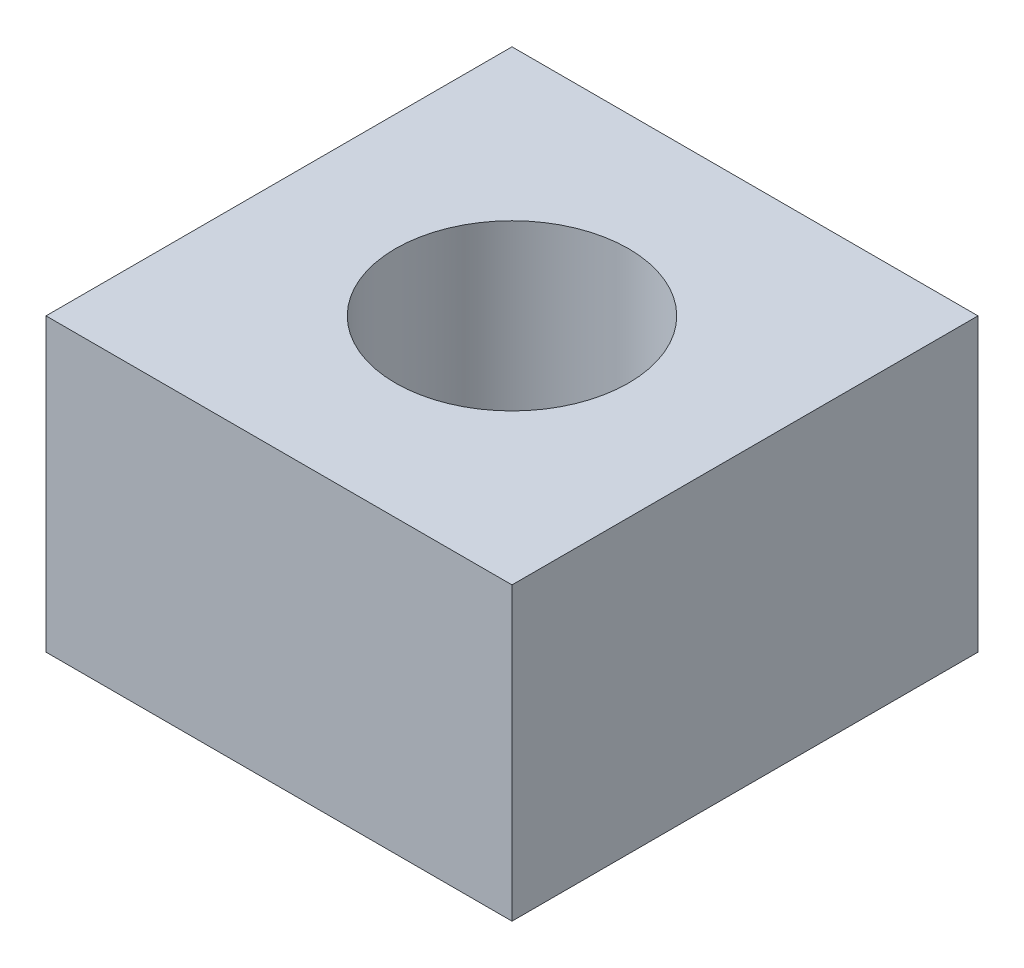
from build123d import *

# Parameters (mm, degrees)
SKETCH_1_W      = 80
SKETCH_1_H      = 80
SKETCH_1_R      = 20
EXTRUDE_1_DEPTH = 50


with BuildPart() as part:
    # 草图1 → 凸台-拉伸1 (new body)
    with BuildSketch(Plane(origin=(0, 0, 0), x_dir=(1, 0, 0), z_dir=(0, 1, 0))):
        Rectangle(SKETCH_1_W, SKETCH_1_H)
        with Locations(Location((0, 0, 0), (0, 0, 270))):
            Circle(SKETCH_1_R, mode=Mode.SUBTRACT)
    extrude(amount=EXTRUDE_1_DEPTH)


solid = part.part
